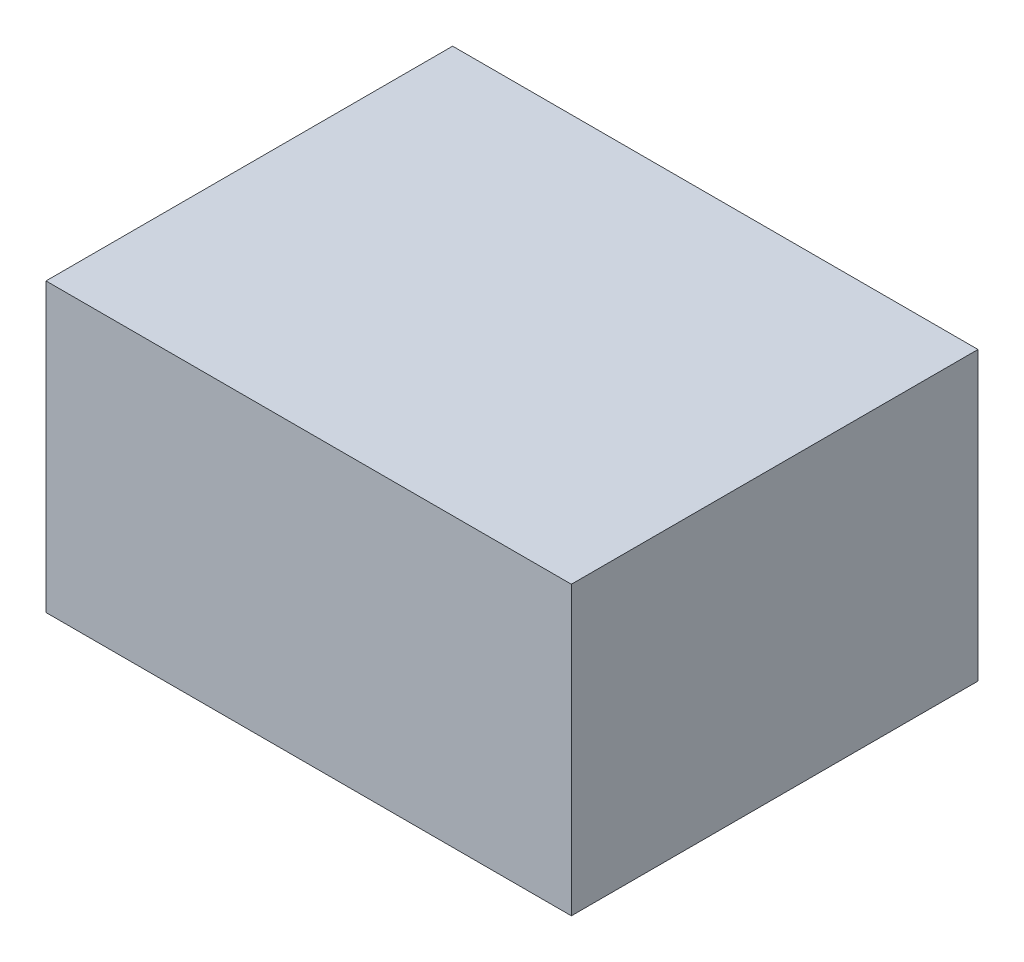
from build123d import *

# Parameters (mm, degrees)
SK_BODY_W  = 45.22
SK_BODY_H  = 24.72
BODY_DEPTH = 35


with BuildPart() as part:
    # SK_Body → Body (new body)
    with BuildSketch(Plane.XY.offset(-35)):
        with Locations((10.11, 0)):
            Rectangle(SK_BODY_W, SK_BODY_H)
    extrude(amount=BODY_DEPTH)


solid = part.part
